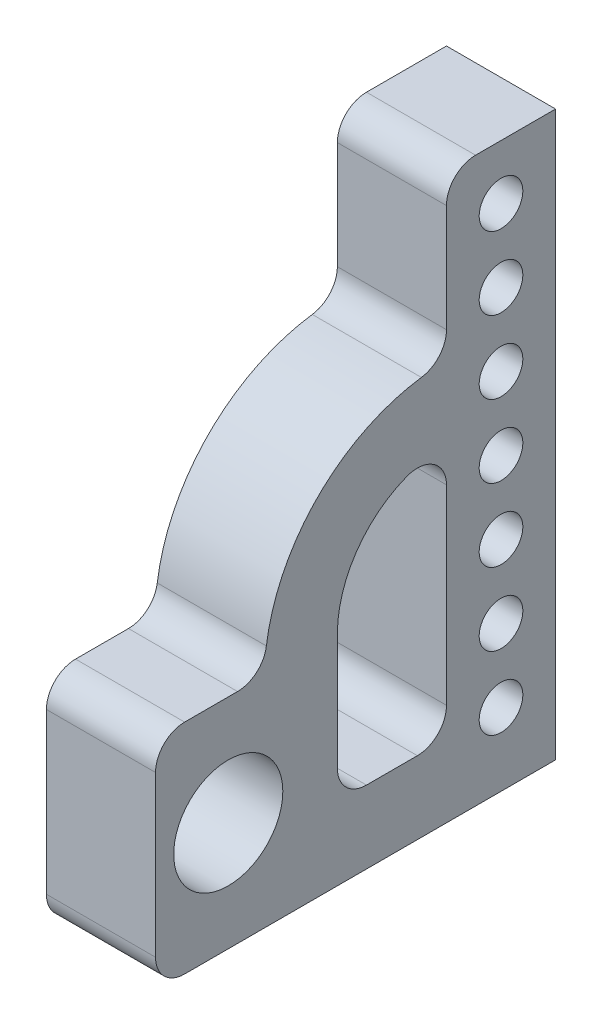
from build123d import *

# Parameters (mm, degrees)
SKETCH1_R           = 15
SKETCH1_R_2         = 6
BOSS_EXTRUDE1_DEPTH = 30
FILLET1_R           = 8


with BuildPart() as part:
    # Sketch1 → Boss-Extrude1 (new body)
    with BuildSketch(Plane.YZ):
        with BuildLine():
            Line((0, 0), (0, 110))
            Line((0, 110), (60, 110))
            Line((60, 110), (60, 80))
            ThreePointArc((60, 80), (95.355339059, 65.355339059), (110, 30))
            Line((110, 30), (155, 30))
            Line((155, 30), (155, 0))
            Line((155, 0), (0, 0))
        make_face()
        with Locations(Location((30, 90, 0), (0, 0, 270))):
            Circle(SKETCH1_R, mode=Mode.SUBTRACT)
        with Locations(Location((20, 15, 0), (0, 0, 270))):
            Circle(SKETCH1_R_2, mode=Mode.SUBTRACT)
        with Locations(Location((40, 15, 0), (0, 0, 270))):
            Circle(SKETCH1_R_2, mode=Mode.SUBTRACT)
        with Locations(Location((60, 15, 0), (0, 0, 270))):
            Circle(SKETCH1_R_2, mode=Mode.SUBTRACT)
        with Locations(Location((80, 15, 0), (0, 0, 270))):
            Circle(SKETCH1_R_2, mode=Mode.SUBTRACT)
        with Locations(Location((100, 15, 0), (0, 0, 270))):
            Circle(SKETCH1_R_2, mode=Mode.SUBTRACT)
        with Locations(Location((120, 15, 0), (0, 0, 270))):
            Circle(SKETCH1_R_2, mode=Mode.SUBTRACT)
        with Locations(Location((140, 15, 0), (0, 0, 270))):
            Circle(SKETCH1_R_2, mode=Mode.SUBTRACT)
        with BuildLine():
            Line((90, 30), (20, 30))
            Line((20, 30), (20, 60))
            Line((20, 60), (60, 60))
            ThreePointArc((60, 60), (81.213203436, 51.213203436), (90, 30))
        make_face(mode=Mode.SUBTRACT)
    extrude(amount=BOSS_EXTRUDE1_DEPTH)

    # Fillet1
    fillet1_edges = [part.edges().sort_by_distance(p)[0] for p in [
        (15, 20, 60),
        (15, 20, 30),
        (15, 90, 30),
        (15, 110, 30),
        (15, 155, 30),
        (15, 0, 110),
        (15, 60, 110),
        (15, 60, 80),
    ]]
    fillet(fillet1_edges, radius=FILLET1_R)


solid = part.part
